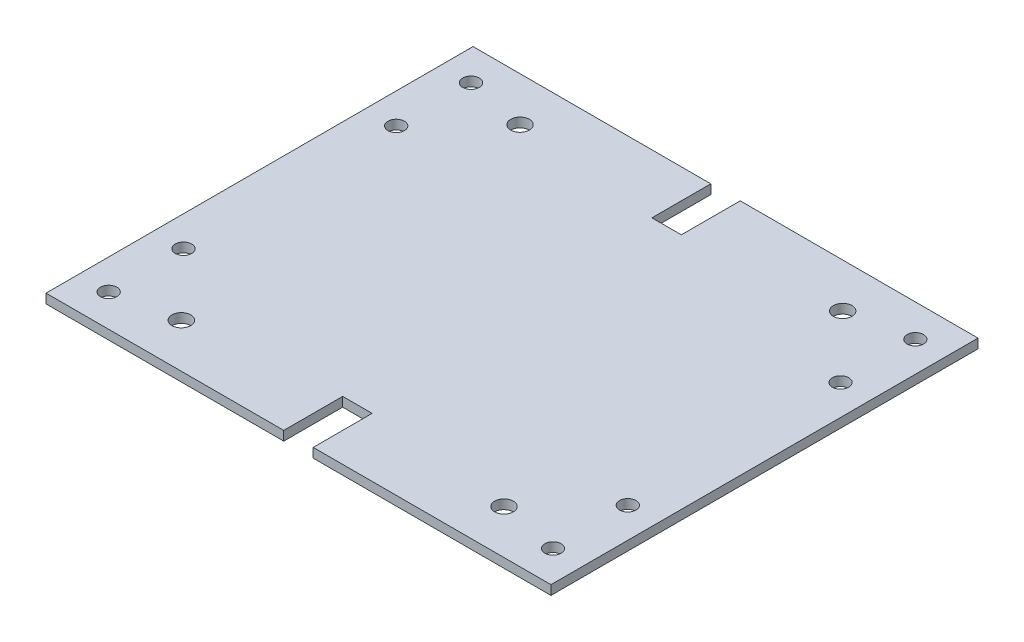
from build123d import *

# Parameters (mm, degrees)
SKETCH1_R           = 3.175
SKETCH1_R_2         = 2.794
BOSS_EXTRUDE3_DEPTH = 3.175


with BuildPart() as part:
    # Sketch1 → Boss-Extrude3 (new body)
    with BuildSketch(Plane(origin=(0, 0, 0), x_dir=(1, 0, 0), z_dir=(0, 1, 0))):
        Polygon((0, 0), (64.775, 0), (64.775, 20), (74.775, 20), (74.775, 0), (155.5, 0), (155.5, 145), (139.55, 145), (74.775, 145), (74.775, 125), (64.775, 125), (64.775, 130), (64.775, 145), (0, 145), (-15.95, 145), (-15.95, 0), align=None)
        with Locations(Location((15, 130, 0), (0, 0, 270))):
            Circle(SKETCH1_R, mode=Mode.SUBTRACT)
        with Locations(Location((124.55, 130, 0), (0, 0, 90))):
            Circle(SKETCH1_R, mode=Mode.SUBTRACT)
        with Locations(Location((15, 15, 0), (0, 0, 90))):
            Circle(SKETCH1_R, mode=Mode.SUBTRACT)
        with Locations(Location((124.55, 15, 0), (0, 0, 270))):
            Circle(SKETCH1_R, mode=Mode.SUBTRACT)
        with Locations(Location((-5.663, 134.0145, 0), (0, 0, 270))):
            Circle(SKETCH1_R_2, mode=Mode.SUBTRACT)
        with Locations(Location((-5.663, 108.6145, 0), (0, 0, 270))):
            Circle(SKETCH1_R_2, mode=Mode.SUBTRACT)
        with Locations(Location((145.213, 134.0145, 0), (0, 0, 90))):
            Circle(SKETCH1_R_2, mode=Mode.SUBTRACT)
        with Locations(Location((145.213, 108.6145, 0), (0, 0, 90))):
            Circle(SKETCH1_R_2, mode=Mode.SUBTRACT)
        with Locations(Location((-5.663, 36.3855, 0), (0, 0, 90))):
            Circle(SKETCH1_R_2, mode=Mode.SUBTRACT)
        with Locations(Location((-5.663, 10.9855, 0), (0, 0, 90))):
            Circle(SKETCH1_R_2, mode=Mode.SUBTRACT)
        with Locations(Location((145.213, 10.9855, 0), (0, 0, 270))):
            Circle(SKETCH1_R_2, mode=Mode.SUBTRACT)
        with Locations(Location((145.213, 36.3855, 0), (0, 0, 270))):
            Circle(SKETCH1_R_2, mode=Mode.SUBTRACT)
    extrude(amount=BOSS_EXTRUDE3_DEPTH)


solid = part.part
